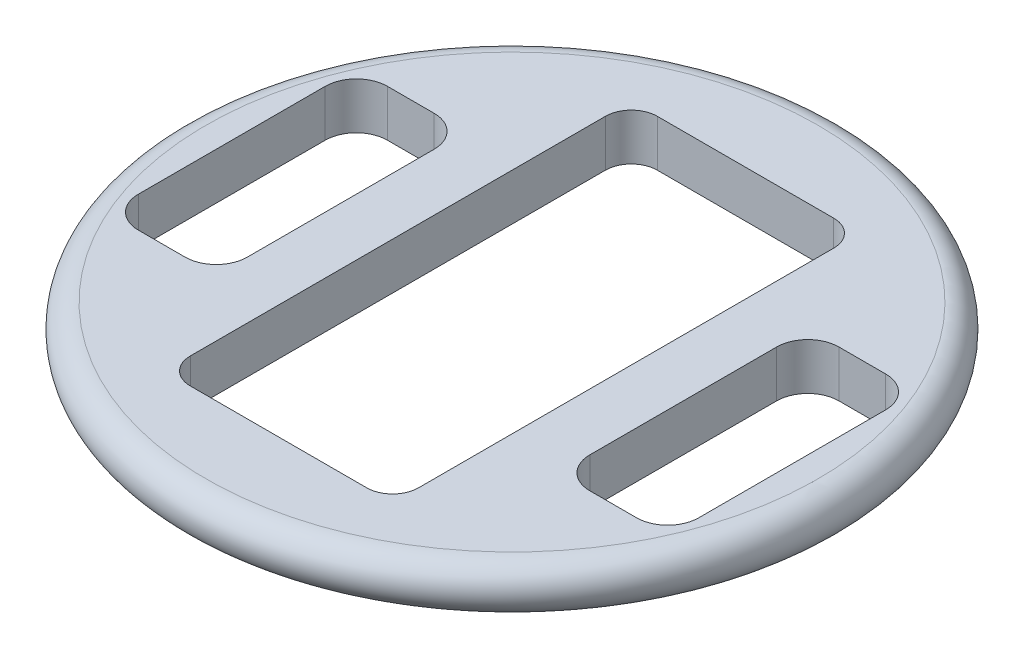
from build123d import *

# Parameters (mm, degrees)
SKETCH1_R           = 29.5
BOSS_EXTRUDE1_DEPTH = 4.5
CUT_EXTRUDE1_DEPTH  = 42.961291687
CUT_EXTRUDE2_DEPTH  = 42.961291687


with BuildPart() as part:
    # Sketch1 → Boss-Extrude1 (new body)
    with BuildSketch(Plane(origin=(0, 0, 0), x_dir=(1, 0, 0), z_dir=(0, 1, 0))):
        with Locations(Location((0, 0, 0), (0, 0, 270))):
            Circle(SKETCH1_R)
    extrude(amount=BOSS_EXTRUDE1_DEPTH)

    # Sketch2 → Cut-Extrude1 (cut, through all)
    with BuildSketch(Plane(origin=(0, 4.5, 0), x_dir=(1, 0, 0), z_dir=(0, 1, 0))):
        with BuildLine():
            Line((-8.5, -22.5), (8.5, -22.5))
            ThreePointArc((8.5, -22.5), (10.267766953, -21.767766953), (11, -20))
            Line((11, -20), (11, 20))
            ThreePointArc((11, 20), (10.267766953, 21.767766953), (8.5, 22.5))
            Line((8.5, 22.5), (-8.5, 22.5))
            ThreePointArc((-8.5, 22.5), (-10.267766953, 21.767766953), (-11, 20))
            Line((-11, 20), (-11, -20))
            ThreePointArc((-11, -20), (-10.267766953, -21.767766953), (-8.5, -22.5))
        make_face()
    extrude(amount=-CUT_EXTRUDE1_DEPTH, mode=Mode.SUBTRACT)

    # Sketch3 → Cut-Extrude2 (cut, through all)
    with BuildSketch(Plane(origin=(0, 4.5, 0), x_dir=(1, 0, 0), z_dir=(0, 1, 0))):
        with BuildLine():
            ThreePointArc((-27, 9), (-26.121320344, 11.121320344), (-24, 12))
            Line((-24, 12), (-19.5, 12))
            ThreePointArc((-19.5, 12), (-17.378679656, 11.121320344), (-16.5, 9))
            Line((-16.5, 9), (-16.5, 0))
            Line((-16.5, 0), (-16.5, -9))
            ThreePointArc((-16.5, -9), (-17.378679656, -11.121320344), (-19.5, -12))
            Line((-19.5, -12), (-24, -12))
            ThreePointArc((-24, -12), (-26.121320344, -11.121320344), (-27, -9))
            Line((-27, -9), (-27, 9))
        make_face()
        with BuildLine():
            Line((16.5, -9), (16.5, 0))
            Line((16.5, 0), (16.5, 9))
            ThreePointArc((16.5, 9), (17.378679656, 11.121320344), (19.5, 12))
            Line((19.5, 12), (24, 12))
            ThreePointArc((24, 12), (26.121320344, 11.121320344), (27, 9))
            Line((27, 9), (27, -9))
            ThreePointArc((27, -9), (26.121320344, -11.121320344), (24, -12))
            Line((24, -12), (19.5, -12))
            ThreePointArc((19.5, -12), (17.378679656, -11.121320344), (16.5, -9))
        make_face()
    extrude(amount=-CUT_EXTRUDE2_DEPTH, mode=Mode.SUBTRACT)

    # Sketch4 → Revolve1 (revolve)
    with BuildSketch(Plane(origin=(0, 0, 0), x_dir=(0, 0, -1), z_dir=(1, 0, 0))):
        with BuildLine():
            ThreePointArc((31.75, 2.25), (31.090990258, 3.840990258), (29.5, 4.5))
            Line((29.5, 4.5), (29.5, 0))
            ThreePointArc((29.5, 0), (31.090990258, 0.659009742), (31.75, 2.25))
        make_face()
    revolve(axis=Axis((0, 0, 0), (0, 1, 0)))


solid = part.part
